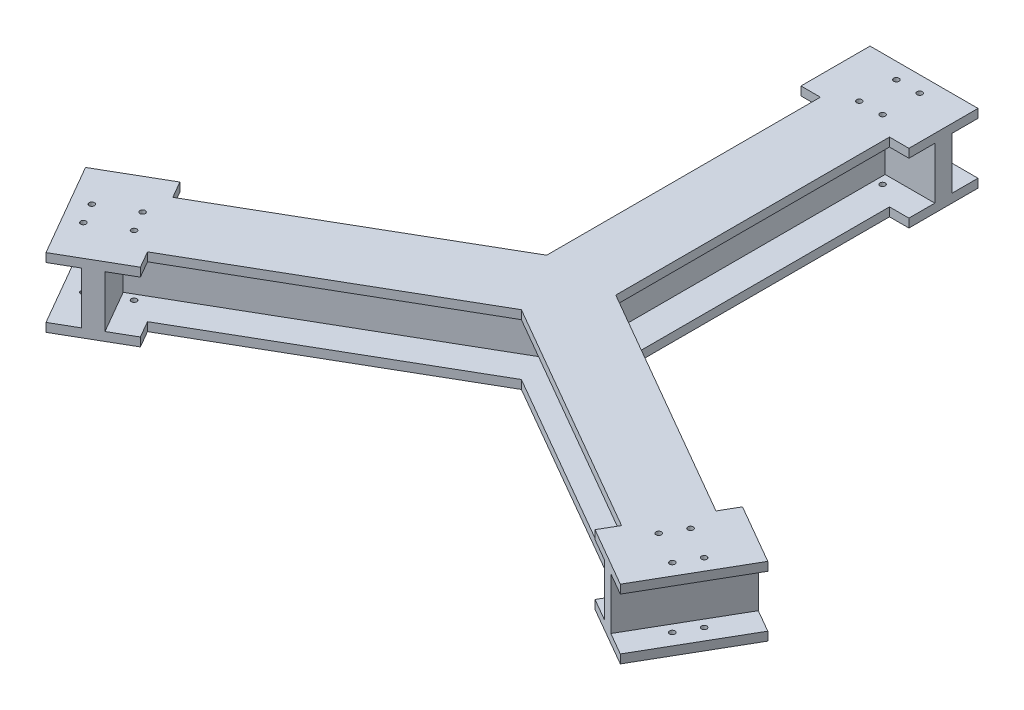
from build123d import *

# Parameters (mm, degrees)
EXTRUDE_1_DEPTH                    = 160
SKETCH_2_W                         = 250
SKETCH_2_H                         = 160
EXTRUDE_2_DEPTH                    = 160
PATTERN_CIRCULAR_1_COUNT           = 3
SKETCH_3_W                         = 633.811978465
SKETCH_3_H                         = 120
CUT_EXTRUDE_1_DEPTH                = 70
SKETCH_4_W                         = 250
SKETCH_4_H                         = 120
CUT_EXTRUDE_2_DEPTH                = 60
SKETCH_5_W                         = 250
SKETCH_5_H                         = 120
CUT_EXTRUDE_3_DEPTH                = 60
SKETCH_6_W                         = 60
SKETCH_6_H                         = 120
EXTRUDE_3_DEPTH                    = 20
PATTERN_CIRCULAR_4_COUNT           = 3
PATTERN_CIRCULAR_4_COPY_1_SKETCH_W = 633.811978465
PATTERN_CIRCULAR_4_COPY_1_SKETCH_H = 120
PATTERN_CIRCULAR_4_COPY_1_DEPTH    = 70
PATTERN_CIRCULAR_4_COPY_2_SKETCH_W = 633.811978465
PATTERN_CIRCULAR_4_COPY_2_SKETCH_H = 120
PATTERN_CIRCULAR_4_COPY_2_DEPTH    = 70
CUT_EXTRUDE_4_DEPTH                = 120
M14X1_5_1_D                        = 12.5
PATTERN_CIRCULAR_5_COUNT           = 3


with BuildPart() as part:
    # 草圖1 → 填料-伸長1 (new body)
    with BuildSketch(Plane(origin=(0, 0, 0), x_dir=(1, 0, 0), z_dir=(0, 1, 0))):
        Polygon((-80, 46.188021535), (-80, 680), (80, 680), (80, 46.188021535), (628.897274573, -270.717967697), (548.897274573, -409.282032303), (0, -92.37604307), (-548.897274573, -409.282032303), (-628.897274573, -270.717967697), align=None)
    extrude(amount=EXTRUDE_1_DEPTH)

    # 草圖2 → 填料-伸長2 (add)
    with BuildSketch(Plane(origin=(0, 160, 0), x_dir=(1, 0, 0), z_dir=(0, 1, 0))):
        with Locations((0, 760)):
            Rectangle(SKETCH_2_W, SKETCH_2_H)
    extrude_2 = extrude(amount=-EXTRUDE_2_DEPTH)

    # 環狀複製排列1: 填料-伸長2 ×3 about axis
    pattern_circular_1_axis = Axis((0, 0, 0), (0, 1, 0))
    for i in range(1, PATTERN_CIRCULAR_1_COUNT):
        add(extrude_2.rotate(pattern_circular_1_axis, i * 360 / PATTERN_CIRCULAR_1_COUNT))

    # 草圖3 → 除料-伸長1 (cut)
    with BuildSketch(Plane(origin=(80, 0, 0), x_dir=(0, 0, -1), z_dir=(1, 0, 0))):
        with Locations((363.094010767, 80)):
            Rectangle(SKETCH_3_W, SKETCH_3_H)
    cut_extrude_1 = extrude(amount=-CUT_EXTRUDE_1_DEPTH, mode=Mode.SUBTRACT)

    # 鏡射1: 除料-伸長1 across plane
    add(cut_extrude_1.mirror(Plane(origin=(0, 0, 0), x_dir=(0, 0, 1), z_dir=(1, 0, 0))), mode=Mode.SUBTRACT)

    # 草圖4 → 除料-伸長2 (cut)
    with BuildSketch(Plane.XY.offset(-680)):
        with Locations((0, 80)):
            Rectangle(SKETCH_4_W, SKETCH_4_H)
    cut_extrude_2 = extrude(amount=-CUT_EXTRUDE_2_DEPTH, mode=Mode.SUBTRACT)

    # 草圖5 → 除料-伸長3 (cut)
    with BuildSketch(Plane(origin=(0, 0, -840), x_dir=(-1, 0, 0), z_dir=(0, 0, -1))):
        with Locations((0, 80)):
            Rectangle(SKETCH_5_W, SKETCH_5_H)
    cut_extrude_3 = extrude(amount=-CUT_EXTRUDE_3_DEPTH, mode=Mode.SUBTRACT)

    # 草圖6 → 填料-伸長3 (add)
    with BuildSketch(Plane.ZY.offset(10)):
        with Locations((-710, 80)):
            Rectangle(SKETCH_6_W, SKETCH_6_H)
    extrude_3 = extrude(amount=-EXTRUDE_3_DEPTH)

    # 環狀複製排列4: 除料-伸長1, 除料-伸長2, 除料-伸長3, 填料-伸長3 ×3 about axis
    pattern_circular_4_axis = Axis((0, 0, 0), (0, 1, 0))
    add([cut_extrude_1.rotate(pattern_circular_4_axis, i * 360 / PATTERN_CIRCULAR_4_COUNT) for i in range(1, PATTERN_CIRCULAR_4_COUNT)], mode=Mode.SUBTRACT)
    add([cut_extrude_2.rotate(pattern_circular_4_axis, i * 360 / PATTERN_CIRCULAR_4_COUNT) for i in range(1, PATTERN_CIRCULAR_4_COUNT)], mode=Mode.SUBTRACT)
    add([cut_extrude_3.rotate(pattern_circular_4_axis, i * 360 / PATTERN_CIRCULAR_4_COUNT) for i in range(1, PATTERN_CIRCULAR_4_COUNT)], mode=Mode.SUBTRACT)
    add([extrude_3.rotate(pattern_circular_4_axis, i * 360 / PATTERN_CIRCULAR_4_COUNT) for i in range(1, PATTERN_CIRCULAR_4_COUNT)])

    # 環狀複製排列4 copy 1 sketch → 環狀複製排列4 copy 1 (cut)
    with BuildSketch(Plane(origin=(40, 0, 69.282032303), x_dir=(-0.8660254037844387, 0, 0.4999999999999998), z_dir=(0.4999999999999998, 0, 0.8660254037844387))):
        with Locations((363.094010767, -80)):
            Rectangle(PATTERN_CIRCULAR_4_COPY_1_SKETCH_W, PATTERN_CIRCULAR_4_COPY_1_SKETCH_H)
    extrude(amount=-PATTERN_CIRCULAR_4_COPY_1_DEPTH, mode=Mode.SUBTRACT)

    # 環狀複製排列4 copy 2 sketch → 環狀複製排列4 copy 2 (cut)
    with BuildSketch(Plane(origin=(40, 0, -69.282032303), x_dir=(0.8660254037844384, 0, 0.5000000000000004), z_dir=(0.5000000000000004, 0, -0.8660254037844384))):
        with Locations((363.094010767, -80)):
            Rectangle(PATTERN_CIRCULAR_4_COPY_2_SKETCH_W, PATTERN_CIRCULAR_4_COPY_2_SKETCH_H)
    extrude(amount=-PATTERN_CIRCULAR_4_COPY_2_DEPTH, mode=Mode.SUBTRACT)

    # 草圖7 → 除料-伸長4 (cut)
    with BuildSketch(Plane(origin=(0, 20, 0), x_dir=(1, 0, 0), z_dir=(0, 1, 0))):
        Polygon((-10, 46.188021535), (-80, 46.188021535), (-45, -14.43375673), (-10, 5.773502692), align=None)
        Polygon((10, 46.188021535), (80, 46.188021535), (45, -14.43375673), (10, 5.773502692), align=None)
        Polygon((-35, -31.754264805), (0, -11.547005384), (35, -31.754264805), (0, -92.37604307), align=None)
    extrude(amount=CUT_EXTRUDE_4_DEPTH, mode=Mode.SUBTRACT)

    # M14x1.5 螺紋孔1 (through all)
    with Locations(Plane(origin=(0, 160, 0), x_dir=(-1, 0, 0), z_dir=(0, 1, 0))):
        with Locations((27, -803), (-27, -803), (-27, -717), (27, -717)):
            m14x1_5_1 = Hole(M14X1_5_1_D / 2)

    # 環狀複製排列5: M14x1.5 螺紋孔1 ×3 about axis
    pattern_circular_5_axis = Axis((0, 0, 0), (0, 1, 0))
    for i in range(1, PATTERN_CIRCULAR_5_COUNT):
        add(m14x1_5_1.rotate(pattern_circular_5_axis, i * 360 / PATTERN_CIRCULAR_5_COUNT), mode=Mode.SUBTRACT)


solid = part.part
